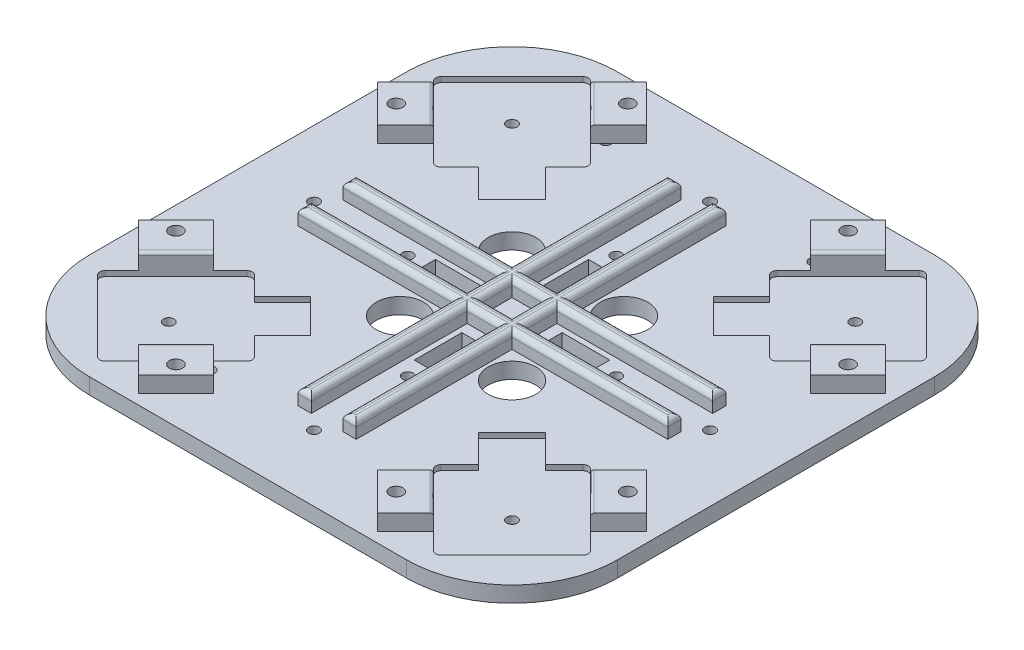
from build123d import *

# Parameters (mm, degrees)
SKETCH_1_W          = 200
SKETCH_1_H          = 200
SKETCH_1_R          = 2
EXTRUDE_1_DEPTH     = 6
CUT_EXTRUDE_1_DEPTH = 2
FILLET_1_R          = 2
EXTRUDE_3_DEPTH     = 6
FILLET_4_R          = 40
SKETCH_4_R          = 2.5
CUT_EXTRUDE_2_DEPTH = 8
SKETCH_5_W          = 5
SKETCH_5_H          = 140
EXTRUDE_4_DEPTH     = 6
SKETCH_6_W          = 140
SKETCH_6_H          = 5
EXTRUDE_5_DEPTH     = 6
FILLET_5_R          = 2
SKETCH_7_R          = 9
SKETCH_7_W          = 18
SKETCH_7_H          = 8
SKETCH_7_W_2        = 8
SKETCH_7_H_2        = 18
CUT_EXTRUDE_3_DEPTH = 6
CUT_EXTRUDE_4_DEPTH = 2
FILLET_6_R          = 1


with BuildPart() as part:
    # Эскиз1 → Бобышка-Вытянуть1 (new body)
    with BuildSketch(Plane(origin=(0, 0, 0), x_dir=(1, 0, 0), z_dir=(0, 1, 0))):
        Rectangle(SKETCH_1_W, SKETCH_1_H)
        with Locations(Location((-39.5, 75, 0), (0, 0, 270))):
            Circle(SKETCH_1_R, mode=Mode.SUBTRACT)
        with Locations(Location((39.5, 75, 0), (0, 0, 270))):
            Circle(SKETCH_1_R, mode=Mode.SUBTRACT)
        with Locations(Location((39.5, -75, 0), (0, 0, 270))):
            Circle(SKETCH_1_R, mode=Mode.SUBTRACT)
        with Locations(Location((-39.5, -75, 0), (0, 0, 270))):
            Circle(SKETCH_1_R, mode=Mode.SUBTRACT)
        with Locations(Location((39.5, 0, 0), (0, 0, 270))):
            Circle(SKETCH_1_R, mode=Mode.SUBTRACT)
        with Locations(Location((-39.5, 0, 0), (0, 0, 270))):
            Circle(SKETCH_1_R, mode=Mode.SUBTRACT)
        with Locations(Location((0, 39.5, 0), (0, 0, 270))):
            Circle(SKETCH_1_R, mode=Mode.SUBTRACT)
        with Locations(Location((0, -39.5, 0), (0, 0, 90))):
            Circle(SKETCH_1_R, mode=Mode.SUBTRACT)
        with Locations(Location((-75, 0, 0), (0, 0, 270))):
            Circle(SKETCH_1_R, mode=Mode.SUBTRACT)
        with Locations(Location((0, 75, 0), (0, 0, 270))):
            Circle(SKETCH_1_R, mode=Mode.SUBTRACT)
        with Locations(Location((75, 0, 0), (0, 0, 270))):
            Circle(SKETCH_1_R, mode=Mode.SUBTRACT)
        with Locations(Location((0, -75, 0), (0, 0, 270))):
            Circle(SKETCH_1_R, mode=Mode.SUBTRACT)
        with Locations(Location((-65, 65, 0), (0, 0, 270))):
            Circle(SKETCH_1_R, mode=Mode.SUBTRACT)
        with Locations(Location((65, 65, 0), (0, 0, 270))):
            Circle(SKETCH_1_R, mode=Mode.SUBTRACT)
        with Locations(Location((65, -65, 0), (0, 0, 270))):
            Circle(SKETCH_1_R, mode=Mode.SUBTRACT)
        with Locations(Location((-65, -65, 0), (0, 0, 270))):
            Circle(SKETCH_1_R, mode=Mode.SUBTRACT)
    extrude(amount=EXTRUDE_1_DEPTH)

    # Эскиз2 → Вырез-Вытянуть1 (cut)
    with BuildSketch(Plane(origin=(0, 6, 0), x_dir=(1, 0, 0), z_dir=(0, 1, 0))):
        Polygon((63.639610307, 33.941125497), (33.941125497, 63.639610307), (63.639610307, 93.338095117), (93.338095117, 63.639610307), align=None)
        Polygon((33.941125497, -63.639610307), (63.639610307, -33.941125497), (93.338095117, -63.639610307), (63.639610307, -93.338095117), align=None)
        Polygon((-63.639610307, -33.941125497), (-33.941125497, -63.639610307), (-63.639610307, -93.338095117), (-93.338095117, -63.639610307), align=None)
        Polygon((-33.941125497, 63.639610307), (-63.639610307, 33.941125497), (-93.338095117, 63.639610307), (-63.639610307, 93.338095117), align=None)
    extrude(amount=-CUT_EXTRUDE_1_DEPTH, mode=Mode.SUBTRACT)

    # Скругление1
    fillet_1_edges = [part.edges().sort_by_distance(p)[0] for p in [
        (-63.639610307, 5, 93.338095117),
        (-63.639610307, 5, -93.338095117),
        (-33.941125497, 5, -63.639610307),
        (-63.639610307, 5, -33.941125497),
        (-93.338095117, 5, -63.639610307),
        (63.639610307, 5, 93.338095117),
        (33.941125497, 5, 63.639610307),
        (63.639610307, 5, 33.941125497),
        (93.338095117, 5, 63.639610307),
        (93.338095117, 5, -63.639610307),
        (63.639610307, 5, -33.941125497),
        (33.941125497, 5, -63.639610307),
        (63.639610307, 5, -93.338095117),
        (-93.338095117, 5, 63.639610307),
        (-63.639610307, 5, 33.941125497),
        (-33.941125497, 5, 63.639610307),
    ]]
    fillet(fillet_1_edges, radius=FILLET_1_R)

    # Эскиз3 → Бобышка-Вытянуть3 (add)
    with BuildSketch(Plane(origin=(0, 6, 0), x_dir=(1, 0, 0), z_dir=(0, 1, 0))):
        Polygon((41.71930009, 71.4177849), (55.861435714, 85.559920524), (45.254833996, 96.166522241), (31.112698372, 82.024386618), align=None)
        Polygon((85.559920524, 55.861435714), (96.166522241, 45.254833996), (82.024386618, 31.112698372), (71.4177849, 41.71930009), align=None)
        Polygon((71.4177849, -41.71930009), (85.559920524, -55.861435714), (96.166522241, -45.254833996), (82.024386618, -31.112698372), align=None)
        Polygon((31.112698372, -82.024386618), (45.254833996, -96.166522241), (55.861435714, -85.559920524), (41.71930009, -71.4177849), align=None)
        Polygon((-41.71930009, -71.4177849), (-55.861435714, -85.559920524), (-45.254833996, -96.166522241), (-31.112698372, -82.024386618), align=None)
        Polygon((-85.559920524, -55.861435714), (-96.166522241, -45.254833996), (-82.024386618, -31.112698372), (-71.4177849, -41.71930009), align=None)
        Polygon((-71.4177849, 41.71930009), (-85.559920524, 55.861435714), (-96.166522241, 45.254833996), (-82.024386618, 31.112698372), align=None)
        Polygon((-31.112698372, 82.024386618), (-45.254833996, 96.166522241), (-55.861435714, 85.559920524), (-41.71930009, 71.4177849), align=None)
    extrude(amount=EXTRUDE_3_DEPTH)

    # Скругление4
    fillet_4_edges = [part.edges().sort_by_distance(p)[0] for p in [
        (100, 3, 100),
        (-100, 3, 100),
        (-100, 3, -100),
        (100, 3, -100),
    ]]
    fillet(fillet_4_edges, radius=FILLET_4_R)

    # Эскиз4 → Вырез-Вытянуть2 (cut)
    with BuildSketch(Plane(origin=(0, 12, 0), x_dir=(1, 0, 0), z_dir=(0, 1, 0))):
        with Locations(Location((41.71930009, 85.559920524, 0), (0, 0, 270))):
            Circle(SKETCH_4_R)
        with Locations(Location((85.559920524, 41.71930009, 0), (0, 0, 90))):
            Circle(SKETCH_4_R)
        with Locations(Location((85.559920524, -41.71930009, 0), (0, 0, 270))):
            Circle(SKETCH_4_R)
        with Locations(Location((41.71930009, -85.559920524, 0), (0, 0, 90))):
            Circle(SKETCH_4_R)
        with Locations(Location((-41.71930009, -85.559920524, 0), (0, 0, 270))):
            Circle(SKETCH_4_R)
        with Locations(Location((-85.559920524, -41.71930009, 0), (0, 0, 90))):
            Circle(SKETCH_4_R)
        with Locations(Location((-85.559920524, 41.71930009, 0), (0, 0, 270))):
            Circle(SKETCH_4_R)
        with Locations(Location((-41.71930009, 85.559920524, 0), (0, 0, 90))):
            Circle(SKETCH_4_R)
    extrude(amount=-CUT_EXTRUDE_2_DEPTH, mode=Mode.SUBTRACT)

    # Эскиз5 → Бобышка-Вытянуть4 (add)
    with BuildSketch(Plane(origin=(0, 6, 0), x_dir=(1, 0, 0), z_dir=(0, 1, 0))):
        with Locations((-8.5, 0)):
            Rectangle(SKETCH_5_W, SKETCH_5_H)
        with Locations((8.5, 0)):
            Rectangle(SKETCH_5_W, SKETCH_5_H)
    extrude(amount=EXTRUDE_4_DEPTH)

    # Эскиз6 → Бобышка-Вытянуть5 (add)
    with BuildSketch(Plane(origin=(0, 6, 0), x_dir=(1, 0, 0), z_dir=(0, 1, 0))):
        with Locations((0, 8.5)):
            Rectangle(SKETCH_6_W, SKETCH_6_H)
        with Locations((0, -8.5)):
            Rectangle(SKETCH_6_W, SKETCH_6_H)
    extrude(amount=EXTRUDE_5_DEPTH)

    # Скругление5
    fillet_5_edges = [part.edges().sort_by_distance(p)[0] for p in [
        (11, 12, 40.5),
        (8.5, 12, -70),
        (6, 12, -40.5),
        (8.5, 12, 70),
        (-6, 12, 40.5),
        (-8.5, 12, -70),
        (-11, 12, -40.5),
        (-8.5, 12, 70),
        (-6, 12, -40.5),
        (-11, 12, 0),
        (11, 12, -40.5),
        (6, 12, 0),
        (40.5, 12, -6),
        (70, 12, -8.5),
        (40.5, 12, -11),
        (0, 12, -11),
        (0, 12, -6),
        (-40.5, 12, -11),
        (-70, 12, -8.5),
        (-40.5, 12, -6),
        (11, 12, 0),
        (-11, 12, 40.5),
        (-6, 12, 0),
        (6, 12, 40.5),
        (40.5, 12, 11),
        (70, 12, 8.5),
        (40.5, 12, 6),
        (0, 12, 6),
        (0, 12, 11),
        (-40.5, 12, 6),
        (-70, 12, 8.5),
        (-40.5, 12, 11),
    ]]
    fillet(fillet_5_edges, radius=FILLET_5_R)

    # Эскиз7 → Вырез-Вытянуть3 (cut)
    with BuildSketch(Plane(origin=(0, 6, 0), x_dir=(1, 0, 0), z_dir=(0, 1, 0))):
        with Locations(Location((21.213203436, 21.213203436, 0), (0, 0, 270))):
            Circle(SKETCH_7_R)
        with Locations(Location((21.213203436, -21.213203436, 0), (0, 0, 270))):
            Circle(SKETCH_7_R)
        with Locations(Location((-21.213203436, -21.213203436, 0), (0, 0, 270))):
            Circle(SKETCH_7_R)
        with Locations(Location((-21.213203436, 21.213203436, 0), (0, 0, 270))):
            Circle(SKETCH_7_R)
        with Locations((24, 0)):
            Rectangle(SKETCH_7_W, SKETCH_7_H)
        with Locations((0, 24)):
            Rectangle(SKETCH_7_W_2, SKETCH_7_H_2)
        with Locations((0, -24)):
            Rectangle(SKETCH_7_W_2, SKETCH_7_H_2)
        with Locations((-24, 0)):
            Rectangle(SKETCH_7_W, SKETCH_7_H)
    extrude(amount=-CUT_EXTRUDE_3_DEPTH, mode=Mode.SUBTRACT)

    # Эскиз8 → Вырез-Вытянуть4 (cut)
    with BuildSketch(Plane(origin=(0, 6, 0), x_dir=(1, 0, 0), z_dir=(0, 1, 0))):
        Polygon((44.547727215, 31.819805153), (31.819805153, 44.547727215), (53.033008589, 65.76093065), (65.76093065, 53.033008589), align=None)
        Polygon((65.76093065, -53.033008589), (53.033008589, -65.76093065), (31.819805153, -44.547727215), (44.547727215, -31.819805153), align=None)
        Polygon((-44.547727215, -31.819805153), (-31.819805153, -44.547727215), (-53.033008589, -65.76093065), (-65.76093065, -53.033008589), align=None)
        Polygon((-65.76093065, 53.033008589), (-53.033008589, 65.76093065), (-31.819805153, 44.547727215), (-44.547727215, 31.819805153), align=None)
    extrude(amount=-CUT_EXTRUDE_4_DEPTH, mode=Mode.SUBTRACT)

    # Скругление6
    fillet_6_edges = [part.edges().sort_by_distance(p)[0] for p in [
        (48.790367902, 12, -78.488852712),
        (78.488852712, 12, -48.790367902),
        (78.488852712, 12, 48.790367902),
        (48.790367902, 12, 78.488852712),
        (-48.790367902, 12, 78.488852712),
        (-78.488852712, 12, 48.790367902),
        (-78.488852712, 12, -48.790367902),
        (-48.790367902, 12, -78.488852712),
    ]]
    fillet(fillet_6_edges, radius=FILLET_6_R)


solid = part.part
